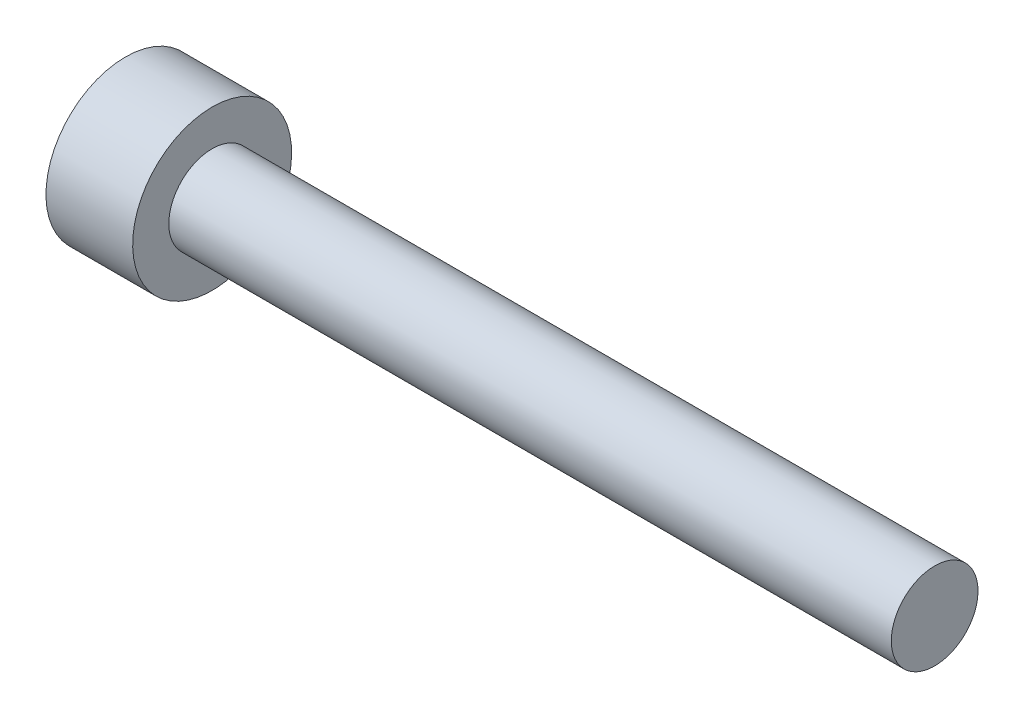
from build123d import *

# Parameters (mm, degrees)
CUT_EXTRUDE1_DEPTH = 1.3


with BuildPart() as part:
    # Sketch1 → Revolve1 (revolve)
    with BuildSketch(Plane.XY):
        Polygon((0, 0), (0, 2.75), (3, 2.75), (3, 1.5), (28, 1.5), (28, 0), align=None)
    revolve(axis=Axis((28, 0, 0), (-1, 0, 0)))

    # Sketch2 → Cut-Extrude1 (cut)
    with BuildSketch(Plane.ZY):
        Polygon((0, 1.472243186), (-1.275, 0.736121593), (-1.275, -0.736121593), (0, -1.472243186), (1.275, -0.736121593), (1.275, 0.736121593), align=None)
    extrude(amount=-CUT_EXTRUDE1_DEPTH, mode=Mode.SUBTRACT)


solid = part.part
